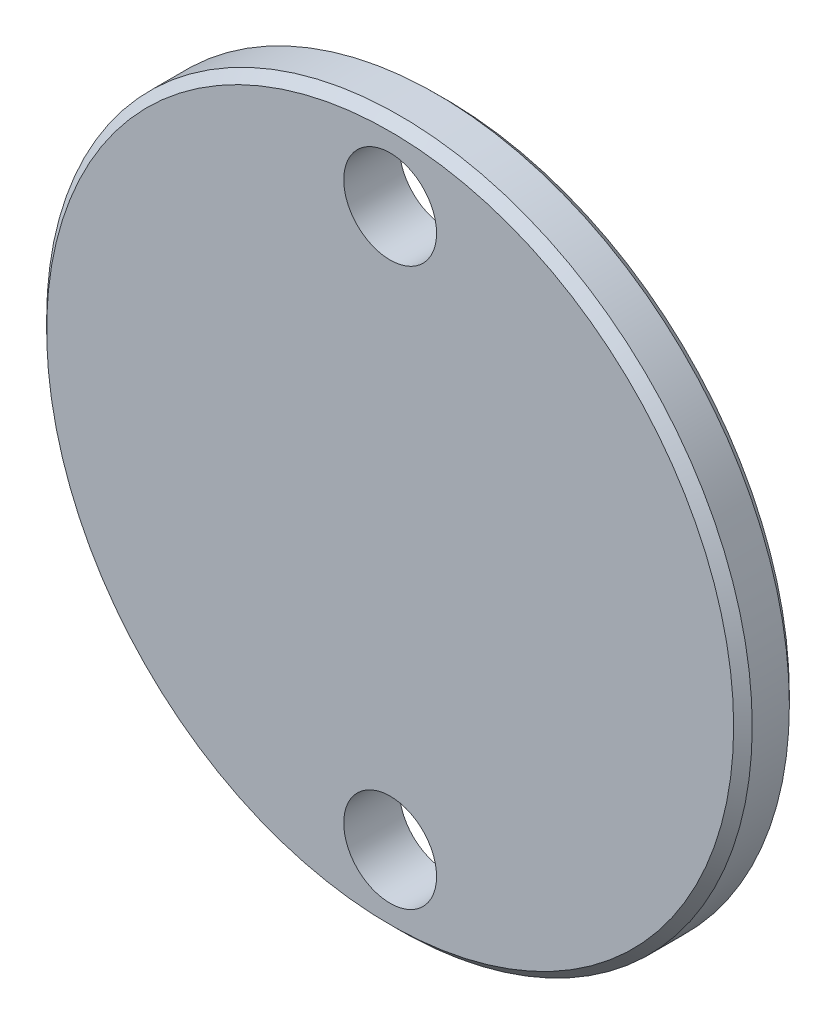
from build123d import *

# Parameters (mm, degrees)
SKETCH_1_R          = 19
EXTRUDE_1_DEPTH     = 3
SKETCH_2_R          = 2.5
CUT_EXTRUDE_1_DEPTH = 13
CHAMFER_1_SIZE      = 0.5


with BuildPart() as part:
    # 草图1 → 拉伸1 (new body)
    with BuildSketch(Plane.XY):
        Circle(SKETCH_1_R)
    extrude(amount=EXTRUDE_1_DEPTH)

    # 草图2 → 切除-拉伸1 (cut)
    with BuildSketch(Plane.XY.offset(3)):
        with Locations((0, 15)):
            Circle(SKETCH_2_R)
        with Locations((0, -15)):
            Circle(SKETCH_2_R)
    extrude(amount=-CUT_EXTRUDE_1_DEPTH, mode=Mode.SUBTRACT)

    # 倒角1
    chamfer_1_edges = [part.edges().sort_by_distance(p)[0] for p in [
        (-19, 0, 0),
        (-19, 0, 3),
    ]]
    chamfer(chamfer_1_edges, length=CHAMFER_1_SIZE)


solid = part.part
